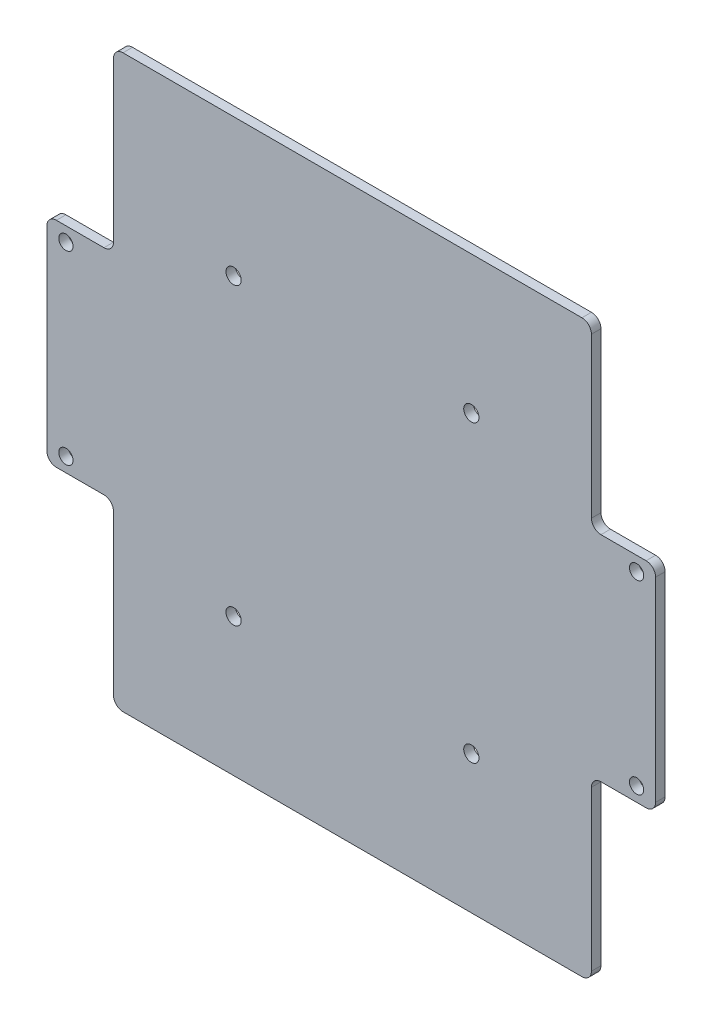
from build123d import *

# Parameters (mm, degrees)
SKETCH_1_W               = 60
SKETCH_1_H               = 70
SKETCH_1_R               = 1.5
EXTRUDE_1_DEPTH          = 2
SKETCH_2_W               = 34
SKETCH_2_H               = 45
EXTRUDE_2_DEPTH          = 2
CUT_EXTRUDE_1_DEPTH      = 1
CUT_EXTRUDE_1_DEPTH_BACK = 118.217746097
SKETCH_3_R               = 1.5
FILLET_1_R               = 2
CUT_EXTRUDE_2_DEPTH      = 118.217746097
PATTERN_LINEAR_1_COUNT   = 4
PATTERN_LINEAR_1_PITCH   = 14
SKETCH_6_W               = 100.507986439
SKETCH_6_H               = 120
EXTRUDE_3_DEPTH          = 2
SKETCH_7_R               = 1.6
CUT_EXTRUDE_3_DEPTH      = 3
FILLET_2_R               = 2


with BuildPart() as part:
    # 草图1 → 凸台-拉伸1 (new body)
    with BuildSketch(Plane.XY):
        with Locations((30, 35)):
            Rectangle(SKETCH_1_W, SKETCH_1_H)
        with Locations((5, 66)):
            Circle(SKETCH_1_R, mode=Mode.SUBTRACT)
        with Locations((5, 4)):
            Circle(SKETCH_1_R, mode=Mode.SUBTRACT)
        with Locations((55, 4)):
            Circle(SKETCH_1_R, mode=Mode.SUBTRACT)
        with Locations((55, 66)):
            Circle(SKETCH_1_R, mode=Mode.SUBTRACT)
    extrude(amount=EXTRUDE_1_DEPTH)

    # 草图2 → 凸台-拉伸2 (add)
    with BuildSketch(Plane.XY.offset(2)):
        with Locations((77, 35)):
            Rectangle(SKETCH_2_W, SKETCH_2_H)
    extrude_2 = extrude(amount=-EXTRUDE_2_DEPTH)

    # 镜向1: 凸台-拉伸2 across plane
    add(extrude_2.mirror(Plane(origin=(30, 0, 0), x_dir=(0, 0, 1), z_dir=(1, 0, 0))))

    # 草图3 → 切除-拉伸1 (cut, two sides: drawn at the far end of the back side and taken through both)
    with BuildSketch(Plane.XY.offset(2).offset(-CUT_EXTRUDE_1_DEPTH_BACK)):
        with Locations((-30, 54.5)):
            Circle(SKETCH_3_R)
        with Locations((90, 54.5)):
            Circle(SKETCH_3_R)
        with Locations((-30, 15.5)):
            Circle(SKETCH_3_R)
        with Locations((90, 15.5)):
            Circle(SKETCH_3_R)
    extrude(amount=CUT_EXTRUDE_1_DEPTH + CUT_EXTRUDE_1_DEPTH_BACK, mode=Mode.SUBTRACT)

    # 圆角1
    fillet_1_edges = [part.edges().sort_by_distance(p)[0] for p in [
        (60, 70, 1),
        (60, 57.5, 1),
        (94, 57.5, 1),
        (94, 12.5, 1),
        (60, 12.5, 1),
        (60, 0, 1),
        (0, 0, 1),
        (0, 12.5, 1),
        (-34, 12.5, 1),
        (0, 70, 1),
        (0, 57.5, 1),
        (-34, 57.5, 1),
    ]]
    fillet(fillet_1_edges, radius=FILLET_1_R)

    # 草图4 → 切除-拉伸2 (cut, through all)
    with BuildSketch(Plane.XY.offset(2)):
        with BuildLine():
            Line((15, 55), (15, 15))
            ThreePointArc((15, 15), (11, 11), (7, 15))
            Line((7, 15), (7, 55))
            ThreePointArc((7, 55), (11, 59), (15, 55))
        make_face()
    cut_extrude_2 = extrude(amount=-CUT_EXTRUDE_2_DEPTH, mode=Mode.SUBTRACT)

    # 阵列(线性)1: 切除-拉伸2 ×4
    with Locations(*[(i * PATTERN_LINEAR_1_PITCH, 0, 0) for i in range(1, PATTERN_LINEAR_1_COUNT)]):
        add(cut_extrude_2, mode=Mode.SUBTRACT)

    # 草图6 → 凸台-拉伸3 (add)
    with BuildSketch(Plane.XY.offset(2)):
        with Locations((30.25399322, 35)):
            Rectangle(SKETCH_6_W, SKETCH_6_H)
    extrude(amount=-EXTRUDE_3_DEPTH)

    # 草图7 → 切除-拉伸3 (cut)
    with BuildSketch(Plane.XY.offset(2)):
        with Locations((5.25399322, 4)):
            Circle(SKETCH_7_R)
        with Locations((55.25399322, 4)):
            Circle(SKETCH_7_R)
        with Locations((5.25399322, 66)):
            Circle(SKETCH_7_R)
        with Locations((55.25399322, 66)):
            Circle(SKETCH_7_R)
    extrude(amount=-CUT_EXTRUDE_3_DEPTH, mode=Mode.SUBTRACT)

    # 圆角2
    fillet_2_edges = [part.edges().sort_by_distance(p)[0] for p in [
        (-20, 57.5, 1),
        (-20, 95, 1),
        (80.507986439, 95, 1),
        (80.507986439, 57.5, 1),
        (80.507986439, 12.5, 1),
        (80.507986439, -25, 1),
        (-20, -25, 1),
        (-20, 12.5, 1),
    ]]
    fillet(fillet_2_edges, radius=FILLET_2_R)


solid = part.part
